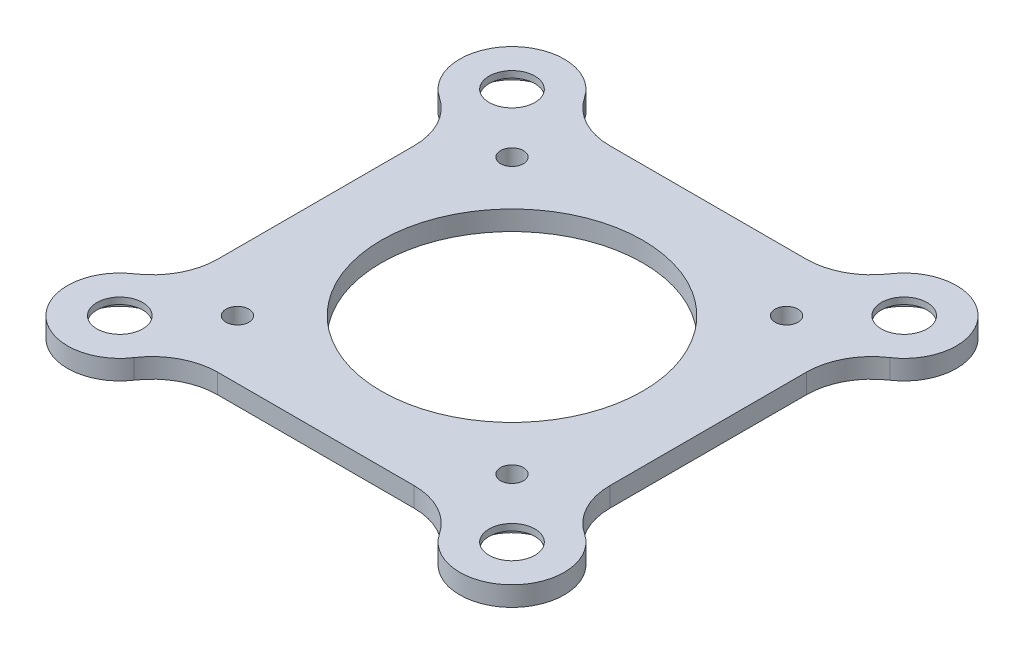
from build123d import *

# Parameters (mm, degrees)
SKETCH_1_R          = 8
SKETCH_1_W          = 60
SKETCH_1_H          = 60
SKETCH_1_R_2        = 20
SKETCH_1_R_3        = 1.75
EXTRUDE_1_DEPTH     = 3
FILLET_1_R          = 10
CUT_EXTRUDE_START   = -3
SKETCH_2_R          = 6
CUT_EXTRUDE_1_DEPTH = 2
SKETCH_2_3_R        = 3.5
CUT_EXTRUDE_3_DEPTH = 97.213304693
CUT_EXTRUDE_6_DEPTH = 1.5


with BuildPart() as part:
    # Эскиз1 → Бобышка-Вытянуть1 (new body)
    # profile 1 of 5: a face of its own
    with BuildSketch(Plane(origin=(0, 0, 0), x_dir=(1, 0, 0), z_dir=(0, 1, 0))):
        with Locations((60, 60)):
            Circle(SKETCH_1_R)
    # profile 2 of 5: a face of its own
    with BuildSketch(Plane(origin=(0, 0, 0), x_dir=(1, 0, 0), z_dir=(0, 1, 0))):
        with Locations((0, 60)):
            Circle(SKETCH_1_R)
    # profile 3 of 5: a face of its own
    with BuildSketch(Plane(origin=(0, 0, 0), x_dir=(1, 0, 0), z_dir=(0, 1, 0))):
        with Locations((60, 0)):
            Circle(SKETCH_1_R)
    # profile 4 of 5: a face of its own
    with BuildSketch(Plane(origin=(0, 0, 0), x_dir=(1, 0, 0), z_dir=(0, 1, 0))):
        Circle(SKETCH_1_R)
    # profile 5 of 5: a face of its own
    with BuildSketch(Plane(origin=(0, 0, 0), x_dir=(1, 0, 0), z_dir=(0, 1, 0))):
        with Locations((30, 30)):
            Rectangle(SKETCH_1_W, SKETCH_1_H)
        with Locations(Location((30, 30, 0), (0, 0, 270))):
            Circle(SKETCH_1_R_2, mode=Mode.SUBTRACT)
        with Locations(Location((9, 51, 0), (0, 0, 270))):
            Circle(SKETCH_1_R_3, mode=Mode.SUBTRACT)
        with Locations(Location((51, 51, 0), (0, 0, 270))):
            Circle(SKETCH_1_R_3, mode=Mode.SUBTRACT)
        with Locations(Location((51, 9, 0), (0, 0, 270))):
            Circle(SKETCH_1_R_3, mode=Mode.SUBTRACT)
        with Locations(Location((9, 9, 0), (0, 0, 270))):
            Circle(SKETCH_1_R_3, mode=Mode.SUBTRACT)
    extrude(amount=EXTRUDE_1_DEPTH)

    # Скругление1
    fillet_1_edges = [part.edges().sort_by_distance(p)[0] for p in [
        (0, 1.5, -8),
        (0, 1.5, -52),
        (8, 1.5, -60),
        (52, 1.5, -60),
        (60, 1.5, -52),
        (60, 1.5, -8),
        (52, 1.5, 0),
        (8, 1.5, 0),
    ]]
    fillet(fillet_1_edges, radius=FILLET_1_R)

    # Эскиз2 → Вырез-Вытянуть1 (cut)
    with BuildSketch(Plane(origin=(0, 3, 0), x_dir=(1, 0, 0), z_dir=(0, 1, 0)).offset(CUT_EXTRUDE_START)):
        with Locations(Location((0, 60, 0), (0, 0, 270))):
            Circle(SKETCH_2_R)
        with Locations(Location((60, 60, 0), (0, 0, 270))):
            Circle(SKETCH_2_R)
        with Locations(Location((60, 0, 0), (0, 0, 270))):
            Circle(SKETCH_2_R)
        with Locations(Location((0, 0, 0), (0, 0, 270))):
            Circle(SKETCH_2_R)
    extrude(amount=CUT_EXTRUDE_1_DEPTH, mode=Mode.SUBTRACT)

    # Эскиз2<3> → Вырез-Вытянуть3 (cut, through all)
    with BuildSketch(Plane(origin=(0, 3, 0), x_dir=(1, 0, 0), z_dir=(0, 1, 0))):
        with Locations(Location((0, 0, 0), (0, 0, 270))):
            Circle(SKETCH_2_3_R)
        with Locations(Location((0, 60, 0), (0, 0, 270))):
            Circle(SKETCH_2_3_R)
        with Locations(Location((60, 60, 0), (0, 0, 270))):
            Circle(SKETCH_2_3_R)
        with Locations(Location((60, 0, 0), (0, 0, 270))):
            Circle(SKETCH_2_3_R)
    extrude(amount=-CUT_EXTRUDE_3_DEPTH, mode=Mode.SUBTRACT)

    # Эскиз5 → Вырез-Вытянуть6 (cut)
    with BuildSketch(Plane(origin=(0, 3, 0), x_dir=(1, 0, 0), z_dir=(0, 1, 0)).offset(CUT_EXTRUDE_START)):
        with BuildLine():
            Line((24.5, 57.5), (35.5, 57.5))
            ThreePointArc((35.5, 57.5), (36.914213562, 56.914213562), (37.5, 55.5))
            Line((37.5, 55.5), (37.5, 54.5))
            ThreePointArc((37.5, 54.5), (36.914213562, 53.085786438), (35.5, 52.5))
            Line((35.5, 52.5), (24.5, 52.5))
            ThreePointArc((24.5, 52.5), (23.085786438, 53.085786438), (22.5, 54.5))
            Line((22.5, 54.5), (22.5, 55.5))
            ThreePointArc((22.5, 55.5), (23.085786438, 56.914213562), (24.5, 57.5))
        make_face()
        with BuildLine():
            Line((37.5, 4.5), (37.5, 5.5))
            ThreePointArc((37.5, 5.5), (36.914213562, 6.914213562), (35.5, 7.5))
            Line((35.5, 7.5), (24.5, 7.5))
            ThreePointArc((24.5, 7.5), (23.085786438, 6.914213562), (22.5, 5.5))
            Line((22.5, 5.5), (22.5, 4.5))
            ThreePointArc((22.5, 4.5), (23.085786438, 3.085786438), (24.5, 2.5))
            Line((24.5, 2.5), (35.5, 2.5))
            ThreePointArc((35.5, 2.5), (36.914213562, 3.085786438), (37.5, 4.5))
        make_face()
    extrude(amount=CUT_EXTRUDE_6_DEPTH, mode=Mode.SUBTRACT)


solid = part.part
